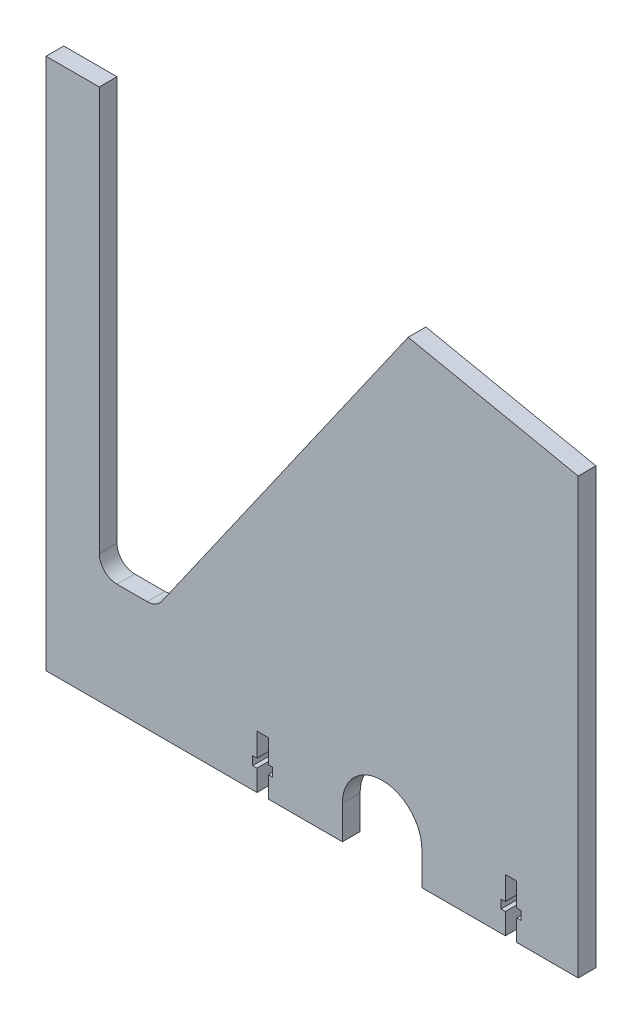
from build123d import *

# Parameters (mm, degrees)
BOSS_EXTRU_1_DEPTH = 5
CONG_1_R           = 5


with BuildPart() as part:
    # Esquisse1 → Boss.-Extru.1 (new body)
    with BuildSketch(Plane.XY):
        with BuildLine():
            Line((-79.883099041, 98.930477667), (-79.883099041, -51.069522333))
            Line((-79.883099041, -51.069522333), (-20.434042124, -51.069522333))
            Line((-20.434042124, -51.069522333), (-20.434042124, -45.101662771))
            Line((-20.434042124, -45.101662771), (-21.634042124, -45.101662771))
            Line((-21.634042124, -45.101662771), (-21.634042124, -42.681662771))
            Line((-21.634042124, -42.681662771), (-20.434042124, -42.681662771))
            Line((-20.434042124, -42.681662771), (-20.434042124, -36.069522333))
            Line((-20.434042124, -36.069522333), (-17.234042124, -36.069522333))
            Line((-17.234042124, -36.069522333), (-17.234042124, -42.681662771))
            Line((-17.234042124, -42.681662771), (-16.034042124, -42.681662771))
            Line((-16.034042124, -42.681662771), (-16.034042124, -45.101662771))
            Line((-16.034042124, -45.101662771), (-17.234042124, -45.101662771))
            Line((-17.234042124, -45.101662771), (-17.234042124, -51.069522333))
            Line((-17.234042124, -51.069522333), (3.640375371, -51.069522333))
            Line((3.640375371, -51.069522333), (3.640375371, -41.637138386))
            ThreePointArc((3.640375371, -41.637138386), (14.83816479, -30.439348967), (26.035954209, -41.637138386))
            Line((26.035954209, -41.637138386), (26.035954209, -51.069522333))
            Line((26.035954209, -51.069522333), (49.565957876, -51.069522333))
            Line((49.565957876, -51.069522333), (49.565957876, -45.101662771))
            Line((49.565957876, -45.101662771), (48.365957876, -45.101662771))
            Line((48.365957876, -45.101662771), (48.365957876, -42.681662771))
            Line((48.365957876, -42.681662771), (49.565957876, -42.681662771))
            Line((49.565957876, -42.681662771), (49.565957876, -36.069522333))
            Line((49.565957876, -36.069522333), (52.765957876, -36.069522333))
            Line((52.765957876, -36.069522333), (52.765957876, -42.681662771))
            Line((52.765957876, -42.681662771), (53.965957876, -42.681662771))
            Line((53.965957876, -42.681662771), (53.965957876, -45.101662771))
            Line((53.965957876, -45.101662771), (52.765957876, -45.101662771))
            Line((52.765957876, -45.101662771), (52.765957876, -51.069522333))
            Line((52.765957876, -51.069522333), (70.116900959, -51.069522333))
            Line((70.116900959, -51.069522333), (70.116900959, -43.569522333))
            Line((70.116900959, -43.569522333), (70.116900959, 71.449147664))
            Line((70.116900959, 71.449147664), (22.19472603, 81.384794059))
            Line((22.19472603, 81.384794059), (-48.758847586, -19.947410672))
            Line((-48.758847586, -19.947410672), (-64.883099041, -19.947410672))
            Line((-64.883099041, -19.947410672), (-64.883099041, 98.930477667))
            Line((-64.883099041, 98.930477667), (-79.883099041, 98.930477667))
        make_face()
    extrude(amount=BOSS_EXTRU_1_DEPTH)

    # Congé1
    cong_1_edges = [part.edges().sort_by_distance(p)[0] for p in [
        (-64.883099041, -19.947410672, 2.5),
        (-48.758847586, -19.947410672, 2.5),
    ]]
    fillet(cong_1_edges, radius=CONG_1_R)


solid = part.part
